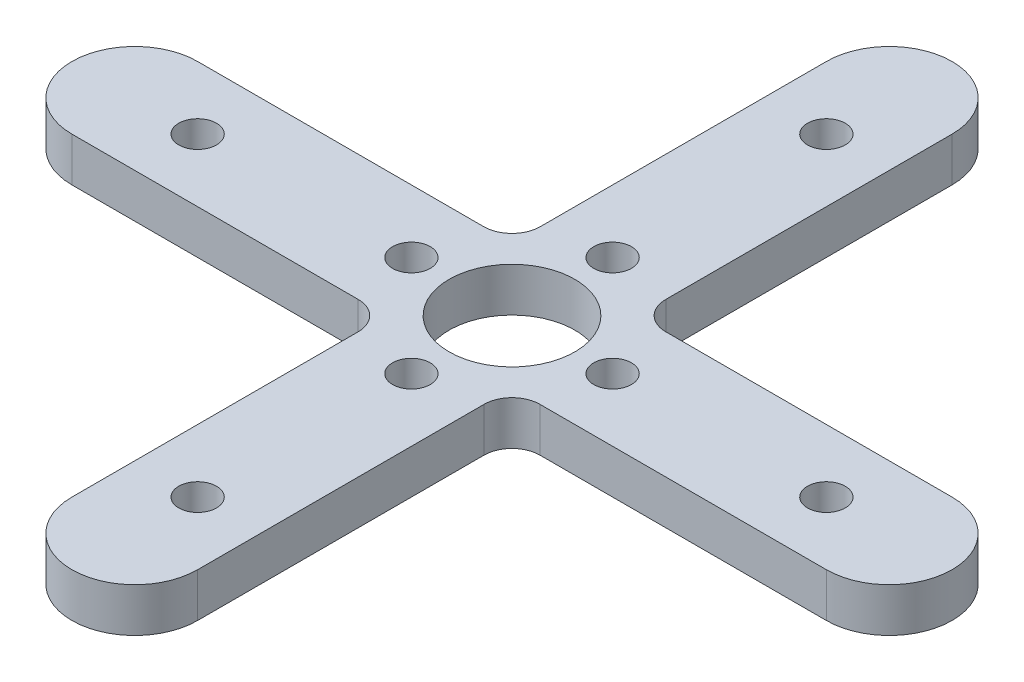
from build123d import *

# Parameters (mm, degrees)
CROQUIS1_R              = 1.5
CROQUIS1_R_2            = 5
SALIENTE_EXTRUIR2_DEPTH = 3.5


with BuildPart() as part:
    # Croquis1 → Saliente-Extruir2 (new body)
    with BuildSketch(Plane(origin=(0, 0, 0), x_dir=(1, 0, 0), z_dir=(0, 1, 0))):
        with BuildLine():
            Line((1.47572532, 11.484579709), (1.47572532, 3.695762793))
            ThreePointArc((1.47572532, 3.695762793), (0.818994747, 2.110274939), (-0.766493108, 1.453544366))
            Line((-0.766493108, 1.453544366), (-23.52427468, 1.453544366))
            ThreePointArc((-23.52427468, 1.453544366), (-28.52427468, -3.546455634), (-23.52427468, -8.546455634))
            Line((-23.52427468, -8.546455634), (-0.766493108, -8.546455634))
            ThreePointArc((-0.766493108, -8.546455634), (0.818994747, -9.203186206), (1.47572532, -10.788674061))
            Line((1.47572532, -10.788674061), (1.47572532, -18.577490976))
            Line((1.47572532, -18.577490976), (1.47572532, -33.546455634))
            ThreePointArc((1.47572532, -33.546455634), (6.47572532, -38.546455634), (11.47572532, -33.546455634))
            Line((11.47572532, -33.546455634), (11.47572532, -10.788674061))
            Line((11.47572532, -10.788674061), (11.47572532, -10.748363891))
            ThreePointArc((11.47572532, -10.748363891), (12.133603326, -9.190173106), (13.697697252, -8.546455634))
            Line((13.697697252, -8.546455634), (36.47572532, -8.546455634))
            ThreePointArc((36.47572532, -8.546455634), (41.47572532, -3.546455634), (36.47572532, 1.453544366))
            Line((36.47572532, 1.453544366), (13.697697252, 1.453544366))
            ThreePointArc((13.697697252, 1.453544366), (12.133603326, 2.097261838), (11.47572532, 3.655452623))
            Line((11.47572532, 3.655452623), (11.47572532, 3.695762793))
            Line((11.47572532, 3.695762793), (11.47572532, 26.453544366))
            ThreePointArc((11.47572532, 26.453544366), (6.47572532, 31.453544366), (1.47572532, 26.453544366))
            Line((1.47572532, 26.453544366), (1.47572532, 11.484579709))
        make_face()
        with Locations(Location((-1.52427468, -3.546455634, 0), (0, 0, 270))):
            Circle(CROQUIS1_R, mode=Mode.SUBTRACT)
        with Locations(Location((6.47572532, -28.546455634, 0), (0, 0, 270))):
            Circle(CROQUIS1_R, mode=Mode.SUBTRACT)
        with Locations(Location((6.47572532, -11.546455634, 0), (0, 0, 270))):
            Circle(CROQUIS1_R, mode=Mode.SUBTRACT)
        with Locations(Location((-18.52427468, -3.546455634, 0), (0, 0, 270))):
            Circle(CROQUIS1_R, mode=Mode.SUBTRACT)
        with Locations(Location((6.47572532, -3.546455634, 0), (0, 0, 270))):
            Circle(CROQUIS1_R_2, mode=Mode.SUBTRACT)
        with Locations(Location((14.47572532, -3.546455634, 0), (0, 0, 270))):
            Circle(CROQUIS1_R, mode=Mode.SUBTRACT)
        with Locations(Location((6.47572532, 4.453544366, 0), (0, 0, 270))):
            Circle(CROQUIS1_R, mode=Mode.SUBTRACT)
        with Locations(Location((31.47572532, -3.546455634, 0), (0, 0, 270))):
            Circle(CROQUIS1_R, mode=Mode.SUBTRACT)
        with Locations(Location((6.47572532, 21.453544366, 0), (0, 0, 270))):
            Circle(CROQUIS1_R, mode=Mode.SUBTRACT)
    extrude(amount=SALIENTE_EXTRUIR2_DEPTH)


solid = part.part
